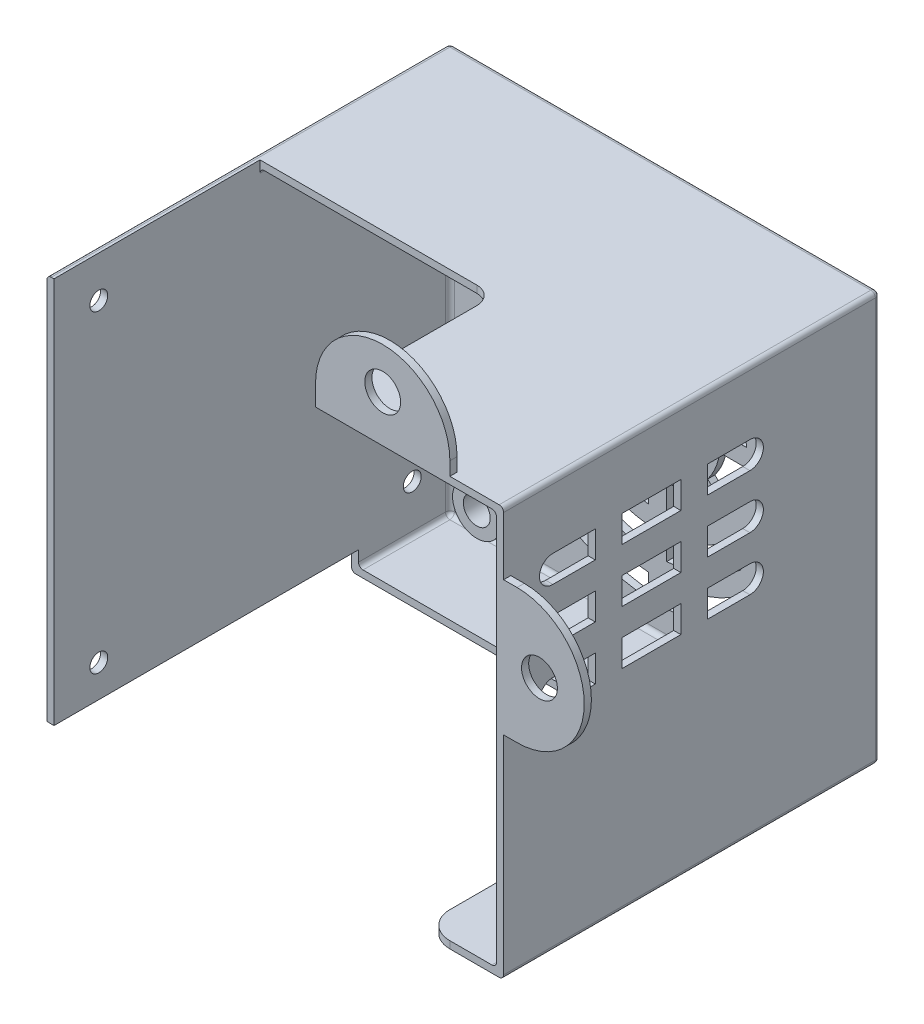
from build123d import *

# Parameters (mm, degrees)
SKETCH1_W                    = 48
SKETCH1_H                    = 45.7
BOSS_EXTRUDE1_DEPTH          = 42
SKETCH2_W                    = 27
SKETCH2_H                    = 20
CUT_EXTRUDE1_DEPTH           = 68.102458971
SKETCH3_W                    = 0.8
SKETCH3_H                    = 43.2
BOSS_EXTRUDE2_DEPTH          = 23
SKETCH4_W                    = 27
SKETCH4_H                    = 2.5
CUT_EXTRUDE2_DEPTH           = 11
CUT_EXTRUDE3_REACH           = 70.493
SKETCH6_W                    = 26.2
SKETCH6_H                    = 11
SKETCH7_W                    = 31
SKETCH7_H                    = 44.9
CUT_EXTRUDE4_DEPTH           = 12
SKETCH8_W                    = 38.2
SKETCH8_H                    = 44.1
CUT_EXTRUDE5_DEPTH           = 10.2
CUT_EXTRUDE6_REACH           = 71.353
SKETCH9_W                    = 41.2
SKETCH9_H                    = 44.1
BOSS_EXTRUDE3_DEPTH          = 0.8
BOSS_EXTRUDE4_DEPTH          = 0.8
SKETCH23_W                   = 2.7
SKETCH23_H                   = 4.2
SKETCH24_W                   = 2.7
SKETCH24_H                   = 4.2
SKETCH25_W                   = 2.7
SKETCH25_H                   = 4.2
SKETCH26_W                   = 2.7
SKETCH26_H                   = 4.2
F_2_0_2_DIAMETER_HOLE1_D     = 2
F_2_0_2_DIAMETER_HOLE1_DEPTH = 0.8
F_4_0_4_DIAMETER_HOLE1_D     = 4
F_4_0_4_DIAMETER_HOLE1_DEPTH = 42
F_3_0_3_DIAMETER_HOLE1_D     = 3
F_3_0_3_DIAMETER_HOLE1_DEPTH = 4.2
FILLET1_R                    = 0.5
FILLET2_R                    = 2
FILLET3_R                    = 3
CUT_EXTRUDE7_DEPTH           = 64.313900527
CIRPATTERN1_COUNT            = 4
CUT_EXTRUDE8_REACH           = 75.429
SKETCH19_W                   = 6.584786498
SKETCH19_H                   = 3


with BuildPart() as part:
    # Sketch1 → Boss-Extrude1 (new body)
    with BuildSketch(Plane.XY.offset(42)):
        with Locations((-1.5, 0.75)):
            Rectangle(SKETCH1_W, SKETCH1_H)
    extrude(amount=-BOSS_EXTRUDE1_DEPTH)

    # Sketch2 → Cut-Extrude1 (cut, through all)
    with BuildSketch(Plane(origin=(0, 23.6, 0), x_dir=(-1, 0, 0), z_dir=(0, 1, 0))):
        with Locations((12, 32)):
            Rectangle(SKETCH2_W, SKETCH2_H)
    extrude(amount=-CUT_EXTRUDE1_DEPTH, mode=Mode.SUBTRACT)

    # Sketch3 → Boss-Extrude2 (add)
    with BuildSketch(Plane.XY.offset(22)):
        with Locations((-25.1, 2)):
            Rectangle(SKETCH3_W, SKETCH3_H)
    extrude(amount=BOSS_EXTRUDE2_DEPTH)

    # Sketch4 → Cut-Extrude2 (cut)
    with BuildSketch(Plane.XY.offset(22)):
        with Locations((-12, -20.85)):
            Rectangle(SKETCH4_W, SKETCH4_H)
    extrude(amount=-CUT_EXTRUDE2_DEPTH, mode=Mode.SUBTRACT)

    # Sketch6 → Cut-Extrude3 (cut, up to next)
    with BuildSketch(Plane(origin=(0, 22.8, 0), x_dir=(1, 0, 0), z_dir=(0, 1, 0)), mode=Mode.PRIVATE) as cut_extrude3_sk1:
        with Locations((-11.6, -16.5)):
            Rectangle(SKETCH6_W, SKETCH6_H)
    cut_extrude3_tool1 = extrude(cut_extrude3_sk1.sketch, amount=-CUT_EXTRUDE3_REACH, mode=Mode.PRIVATE) & part.part
    add(cut_extrude3_tool1.solids().sort_by_distance((-11.6, 22.8, 16.5))[0], mode=Mode.SUBTRACT)

    # Sketch7 → Cut-Extrude4 (cut)
    with BuildSketch(Plane.ZY.offset(-1.5)):
        with Locations((26.5, 0.35)):
            Rectangle(SKETCH7_W, SKETCH7_H)
    extrude(amount=-CUT_EXTRUDE4_DEPTH, mode=Mode.SUBTRACT)

    # Sketch8 → Cut-Extrude5 (cut)
    with BuildSketch(Plane.XY.offset(11)):
        with Locations((-5.6, 0.75)):
            Rectangle(SKETCH8_W, SKETCH8_H)
    extrude(amount=-CUT_EXTRUDE5_DEPTH, mode=Mode.SUBTRACT)

    # Sketch9 → Cut-Extrude6 (cut, up to next)
    with BuildSketch(Plane(origin=(21.7, 0, 0), x_dir=(0, 0, -1), z_dir=(1, 0, 0)), mode=Mode.PRIVATE) as cut_extrude6_sk1:
        with Locations((-21.4, 0.75)):
            Rectangle(SKETCH9_W, SKETCH9_H)
    cut_extrude6_tool1 = extrude(cut_extrude6_sk1.sketch, amount=-CUT_EXTRUDE6_REACH, mode=Mode.PRIVATE) & part.part
    add(cut_extrude6_tool1.solids().sort_by_distance((21.7, 0.75, 21.4))[0], mode=Mode.SUBTRACT)

    # Sketch21 → Boss-Extrude3 (add)
    with BuildSketch(Plane.XY.offset(42)):
        with BuildLine():
            Line((1.5, 25.1), (1.5, 23.6))
            Line((1.5, 23.6), (16.5, 23.6))
            Line((16.5, 23.6), (16.5, 25.1))
            ThreePointArc((16.5, 25.1), (9, 32.6), (1.5, 25.1))
        make_face()
    extrude(amount=-BOSS_EXTRUDE3_DEPTH)

    # Sketch22 → Boss-Extrude4 (add)
    with BuildSketch(Plane.XY.offset(42)):
        with BuildLine():
            Line((24, 16.6), (22.5, 16.6))
            Line((22.5, 16.6), (22.5, 1.6))
            Line((22.5, 1.6), (24, 1.6))
            ThreePointArc((24, 1.6), (31.5, 9.1), (24, 16.6))
        make_face()
    extrude(amount=-BOSS_EXTRUDE4_DEPTH)

    # Sketch23 → Revolve1 (revolve)
    with BuildSketch(Plane.XZ.offset(15.2), mode=Mode.PRIVATE) as revolve1_sk:
        with Locations((-16.15, 2.9)):
            Rectangle(SKETCH23_W, SKETCH23_H)
    revolve(revolve1_sk.sketch.rotate(Axis((-17.5, -15.2, 5), (0, 0, -1)), 180), axis=Axis((-17.5, -15.2, 5), (0, 0, -1)))

    # Sketch24 → Revolve2 (revolve)
    with BuildSketch(Plane.XZ.offset(-16.8), mode=Mode.PRIVATE) as revolve2_sk:
        with Locations((-16.15, 2.9)):
            Rectangle(SKETCH24_W, SKETCH24_H)
    revolve(revolve2_sk.sketch.rotate(Axis((-17.5, 16.8, 5), (0, 0, -1)), 180), axis=Axis((-17.5, 16.8, 5), (0, 0, -1)))

    # Sketch25 → Revolve3 (revolve)
    with BuildSketch(Plane.XZ.offset(15.2), mode=Mode.PRIVATE) as revolve3_sk:
        with Locations((15.85, 2.9)):
            Rectangle(SKETCH25_W, SKETCH25_H)
    revolve(revolve3_sk.sketch.rotate(Axis((14.5, -15.2, 5), (0, 0, -1)), 180), axis=Axis((14.5, -15.2, 5), (0, 0, -1)))

    # Sketch26 → Revolve4 (revolve)
    with BuildSketch(Plane.XZ.offset(-16.8), mode=Mode.PRIVATE) as revolve4_sk:
        with Locations((15.85, 2.9)):
            Rectangle(SKETCH26_W, SKETCH26_H)
    revolve(revolve4_sk.sketch.rotate(Axis((14.5, 16.8, 5), (0, 0, -1)), 180), axis=Axis((14.5, 16.8, 5), (0, 0, -1)))

    # Ø2.0 (2) Diameter Hole1
    with Locations(Plane(origin=(-24.7, 0, 0), x_dir=(0, 0, -1), z_dir=(1, 0, 0))):
        with Locations((-40, 19), (-40, -16), (-5, -16), (-5, 19)):
            Hole(F_2_0_2_DIAMETER_HOLE1_D / 2, depth=F_2_0_2_DIAMETER_HOLE1_DEPTH)

    # Ø4.0 (4) Diameter Hole1
    with Locations(Plane.XY.offset(42)):
        with Locations((9, 28), (26.5, 9.1)):
            Hole(F_4_0_4_DIAMETER_HOLE1_D / 2, depth=F_4_0_4_DIAMETER_HOLE1_DEPTH)

    # Ø3.0 (3) Diameter Hole1
    with Locations(Plane.XY.offset(5)):
        with Locations((14.5, 16.8), (14.5, -15.2), (-17.5, 16.8), (-17.5, -15.2)):
            Hole(F_3_0_3_DIAMETER_HOLE1_D / 2, depth=F_3_0_3_DIAMETER_HOLE1_DEPTH)

    # Fillet1
    fillet1_edges = [part.edges().sort_by_distance(p)[0] for p in [
        (21.7, 0.75, 0.8),
        (21.7, 22.8, 21.4),
        (-25.5, 0.75, 0),
        (-1.5, -22.1, 0),
        (22.5, 0.75, 0),
        (-24.7, 22.8, 11.4),
        (22.5, -22.1, 21),
        (-25.5, -22.1, 5.5),
        (-25.5, 23.6, 22.5),
        (22.5, 23.6, 21),
        (-24.7, 0.75, 0.8),
        (-24.7, -21.3, 5.9),
        (-1.5, 22.8, 0.8),
        (-1.5, -21.3, 0.8),
        (-1.5, 23.6, 0),
        (21.7, -21.3, 21.4),
    ]]
    fillet(fillet1_edges, radius=FILLET1_R)

    # Fillet2
    fillet2_edges = [part.edges().sort_by_distance(p)[0] for p in [
        (1.5, 23.2, 22),
    ]]
    fillet(fillet2_edges, radius=FILLET2_R)

    # Fillet3
    fillet3_edges = [part.edges().sort_by_distance(p)[0] for p in [
        (13.5, -21.7, 42),
        (13.5, -21.7, 11),
    ]]
    fillet(fillet3_edges, radius=FILLET3_R)

    # Outer Rings → Cut-Extrude7 (cut, through all)
    with BuildSketch(Plane.XY.offset(0.8)):
        with BuildLine():
            Line((-2.5, 12.708260743), (-2.5, 15.248260743))
            ThreePointArc((-2.5, 15.248260743), (-6.921065061, 14.230206892), (-10.813547124, 11.899792058))
            Line((-10.813547124, 11.899792058), (-9.105169207, 10.032316593))
            ThreePointArc((-9.105169207, 10.032316593), (-6.005818854, 11.871942117), (-2.5, 12.708260743))
        make_face()
        with BuildLine():
            Line((-20.570260743, 1.75), (-18.030260743, 1.75))
            ThreePointArc((-18.030260743, 1.75), (-16.870462623, 6.905169423), (-14.147202696, 11.433387486))
            Line((-14.147202696, 11.433387486), (-16.023246157, 13.149603457))
            ThreePointArc((-16.023246157, 13.149603457), (-19.237493233, 7.825039124), (-20.570260743, 1.75))
        make_face()
        with BuildLine():
            Line((-15.998260743, 1.75), (-13.458260743, 1.75))
            ThreePointArc((-13.458260743, 1.75), (-12.621942117, 5.255818854), (-10.782316593, 8.355169207))
            Line((-10.782316593, 8.355169207), (-12.649792058, 10.063547124))
            ThreePointArc((-12.649792058, 10.063547124), (-14.980206892, 6.171065061), (-15.998260743, 1.75))
        make_face()
        with BuildLine():
            Line((-2.5, 17.280260743), (-2.5, 19.820260743))
            ThreePointArc((-2.5, 19.820260743), (-8.575039124, 18.487493233), (-13.899603457, 15.273246157))
            Line((-13.899603457, 15.273246157), (-12.183387486, 13.397202696))
            ThreePointArc((-12.183387486, 13.397202696), (-7.655169423, 16.120462623), (-2.5, 17.280260743))
        make_face()
        with BuildLine():
            Line((-9.304004575, 7.00280038), (-7.083697174, 4.971649662))
            ThreePointArc((-7.083697174, 4.971649662), (-7.960005385, 3.44598413), (-8.42820323, 1.75))
            Line((-8.42820323, 1.75), (-11.449874371, 1.75))
            ThreePointArc((-11.449874371, 1.75), (-10.757323175, 4.531794235), (-9.304004575, 7.00280038))
        make_face()
        with BuildLine():
            Line((-7.75280038, 8.554004575), (-5.721649662, 6.333697174))
            ThreePointArc((-5.721649662, 6.333697174), (-4.19598413, 7.210005385), (-2.5, 7.67820323))
            Line((-2.5, 7.67820323), (-2.5, 10.699874371))
            ThreePointArc((-2.5, 10.699874371), (-5.281794235, 10.007323175), (-7.75280038, 8.554004575))
        make_face()
    cut_extrude7 = extrude(amount=-CUT_EXTRUDE7_DEPTH, mode=Mode.SUBTRACT)

    # CirPattern1: Cut-Extrude7 ×4 about axis
    cirpattern1_axis = Axis((-1.5, 0.75, 0), (0, 0, 1))
    for i in range(1, CIRPATTERN1_COUNT):
        add(cut_extrude7.rotate(cirpattern1_axis, i * 360 / CIRPATTERN1_COUNT), mode=Mode.SUBTRACT)

    # Sketch19 → Cut-Extrude8 (cut, up to next)
    with BuildSketch(Plane(origin=(22.5, 0, 0), x_dir=(0, 0, -1), z_dir=(1, 0, 0)), mode=Mode.PRIVATE) as cut_extrude8_sk1:
        with Locations((-25.5, 14.9)):
            Rectangle(SKETCH19_W, SKETCH19_H)
    cut_extrude8_tool1 = extrude(cut_extrude8_sk1.sketch, amount=-CUT_EXTRUDE8_REACH, mode=Mode.PRIVATE) & part.part
    # Sketch19 → Cut-Extrude8 (cut, up to next)
    with BuildSketch(Plane(origin=(22.5, 0, 0), x_dir=(0, 0, -1), z_dir=(1, 0, 0)), mode=Mode.PRIVATE) as cut_extrude8_sk2:
        with BuildLine():
            Line((-19.232417538, 13.4), (-14.5, 13.4))
            ThreePointArc((-14.5, 13.4), (-13, 14.9), (-14.5, 16.4))
            Line((-14.5, 16.4), (-19.232417538, 16.4))
            Line((-19.232417538, 16.4), (-19.232417538, 13.4))
        make_face()
    cut_extrude8_tool2 = extrude(cut_extrude8_sk2.sketch, amount=-CUT_EXTRUDE8_REACH, mode=Mode.PRIVATE) & part.part
    # Sketch19 → Cut-Extrude8 (cut, up to next)
    with BuildSketch(Plane(origin=(22.5, 0, 0), x_dir=(0, 0, -1), z_dir=(1, 0, 0)), mode=Mode.PRIVATE) as cut_extrude8_sk3:
        with BuildLine():
            Line((-19.232417538, 7.4), (-14.5, 7.4))
            ThreePointArc((-14.5, 7.4), (-13, 8.9), (-14.5, 10.4))
            Line((-14.5, 10.4), (-19.232417538, 10.4))
            Line((-19.232417538, 10.4), (-19.232417538, 7.4))
        make_face()
    cut_extrude8_tool3 = extrude(cut_extrude8_sk3.sketch, amount=-CUT_EXTRUDE8_REACH, mode=Mode.PRIVATE) & part.part
    # Sketch19 → Cut-Extrude8 (cut, up to next)
    with BuildSketch(Plane(origin=(22.5, 0, 0), x_dir=(0, 0, -1), z_dir=(1, 0, 0)), mode=Mode.PRIVATE) as cut_extrude8_sk4:
        with Locations((-25.5, 8.9)):
            Rectangle(SKETCH19_W, SKETCH19_H)
    cut_extrude8_tool4 = extrude(cut_extrude8_sk4.sketch, amount=-CUT_EXTRUDE8_REACH, mode=Mode.PRIVATE) & part.part
    # Sketch19 → Cut-Extrude8 (cut, up to next)
    with BuildSketch(Plane(origin=(22.5, 0, 0), x_dir=(0, 0, -1), z_dir=(1, 0, 0)), mode=Mode.PRIVATE) as cut_extrude8_sk5:
        with BuildLine():
            Line((-31.767582462, 10.4), (-36.5, 10.4))
            ThreePointArc((-36.5, 10.4), (-38, 8.9), (-36.5, 7.4))
            Line((-36.5, 7.4), (-31.767582462, 7.4))
            Line((-31.767582462, 7.4), (-31.767582462, 10.4))
        make_face()
    cut_extrude8_tool5 = extrude(cut_extrude8_sk5.sketch, amount=-CUT_EXTRUDE8_REACH, mode=Mode.PRIVATE) & part.part
    # Sketch19 → Cut-Extrude8 (cut, up to next)
    with BuildSketch(Plane(origin=(22.5, 0, 0), x_dir=(0, 0, -1), z_dir=(1, 0, 0)), mode=Mode.PRIVATE) as cut_extrude8_sk6:
        with BuildLine():
            Line((-31.767582462, 4.4), (-36.5, 4.4))
            ThreePointArc((-36.5, 4.4), (-38, 2.9), (-36.5, 1.4))
            Line((-36.5, 1.4), (-31.767582462, 1.4))
            Line((-31.767582462, 1.4), (-31.767582462, 4.4))
        make_face()
    cut_extrude8_tool6 = extrude(cut_extrude8_sk6.sketch, amount=-CUT_EXTRUDE8_REACH, mode=Mode.PRIVATE) & part.part
    # Sketch19 → Cut-Extrude8 (cut, up to next)
    with BuildSketch(Plane(origin=(22.5, 0, 0), x_dir=(0, 0, -1), z_dir=(1, 0, 0)), mode=Mode.PRIVATE) as cut_extrude8_sk7:
        with Locations((-25.5, 2.9)):
            Rectangle(SKETCH19_W, SKETCH19_H)
    cut_extrude8_tool7 = extrude(cut_extrude8_sk7.sketch, amount=-CUT_EXTRUDE8_REACH, mode=Mode.PRIVATE) & part.part
    # Sketch19 → Cut-Extrude8 (cut, up to next)
    with BuildSketch(Plane(origin=(22.5, 0, 0), x_dir=(0, 0, -1), z_dir=(1, 0, 0)), mode=Mode.PRIVATE) as cut_extrude8_sk8:
        with BuildLine():
            Line((-19.232417538, 1.4), (-14.5, 1.4))
            ThreePointArc((-14.5, 1.4), (-13, 2.9), (-14.5, 4.4))
            Line((-14.5, 4.4), (-19.232417538, 4.4))
            Line((-19.232417538, 4.4), (-19.232417538, 1.4))
        make_face()
    cut_extrude8_tool8 = extrude(cut_extrude8_sk8.sketch, amount=-CUT_EXTRUDE8_REACH, mode=Mode.PRIVATE) & part.part
    # Sketch19 → Cut-Extrude8 (cut, up to next)
    with BuildSketch(Plane(origin=(22.5, 0, 0), x_dir=(0, 0, -1), z_dir=(1, 0, 0)), mode=Mode.PRIVATE) as cut_extrude8_sk9:
        with BuildLine():
            Line((-36.5, 13.4), (-31.767582462, 13.4))
            Line((-31.767582462, 13.4), (-31.767582462, 16.4))
            Line((-31.767582462, 16.4), (-36.5, 16.4))
            ThreePointArc((-36.5, 16.4), (-38, 14.9), (-36.5, 13.4))
        make_face()
    cut_extrude8_tool9 = extrude(cut_extrude8_sk9.sketch, amount=-CUT_EXTRUDE8_REACH, mode=Mode.PRIVATE) & part.part
    add(cut_extrude8_tool1.solids().sort_by_distance((22.5, 14.9, 25.5))[0], mode=Mode.SUBTRACT)
    add(cut_extrude8_tool2.solids().sort_by_distance((22.5, 14.9, 16.267678))[0], mode=Mode.SUBTRACT)
    add(cut_extrude8_tool3.solids().sort_by_distance((22.5, 8.9, 16.267678))[0], mode=Mode.SUBTRACT)
    add(cut_extrude8_tool4.solids().sort_by_distance((22.5, 8.9, 25.5))[0], mode=Mode.SUBTRACT)
    add(cut_extrude8_tool5.solids().sort_by_distance((22.5, 8.9, 34.732322))[0], mode=Mode.SUBTRACT)
    add(cut_extrude8_tool6.solids().sort_by_distance((22.5, 2.9, 34.732322))[0], mode=Mode.SUBTRACT)
    add(cut_extrude8_tool7.solids().sort_by_distance((22.5, 2.9, 25.5))[0], mode=Mode.SUBTRACT)
    add(cut_extrude8_tool8.solids().sort_by_distance((22.5, 2.9, 16.267678))[0], mode=Mode.SUBTRACT)
    add(cut_extrude8_tool9.solids().sort_by_distance((22.5, 14.9, 34.732322))[0], mode=Mode.SUBTRACT)


solid = part.part
